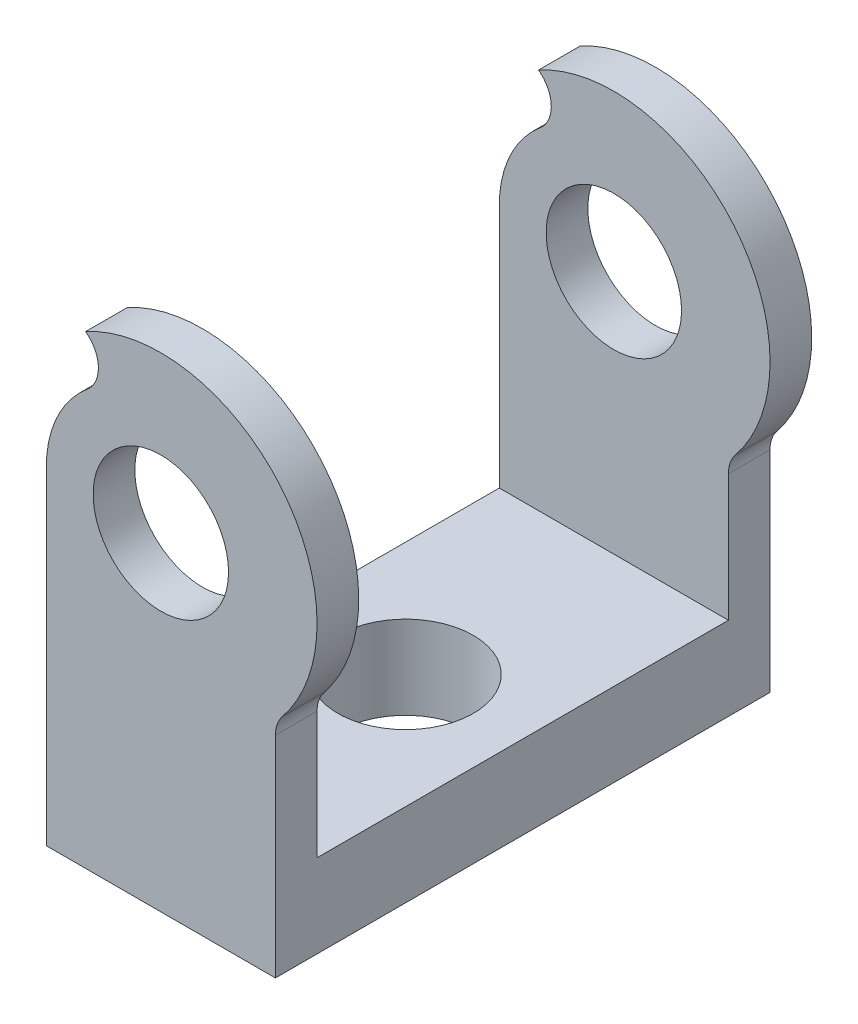
from build123d import *

# Parameters (mm, degrees)
BOSS_EXTRUDE1_DEPTH = 4
SKETCH2_W           = 22
SKETCH2_H           = 8
BOSS_EXTRUDE2_DEPTH = 39.5
BOSS_EXTRUDE3_DEPTH = 4
FILLET1_R           = 3
SKETCH4_R           = 6.5
CUT_EXTRUDE1_DEPTH  = 72.375766196
CUT_EXTRUDE2_REACH  = 73.376
SKETCH5_R           = 6.5


with BuildPart() as part:
    # Sketch1 → Boss-Extrude1 (new body)
    with BuildSketch(Plane.XY):
        with BuildLine():
            Line((0, 0), (22, 0))
            Line((22, 0), (22, 21.301960973))
            ThreePointArc((22, 21.301960973), (22.819670179, 40.735550707), (3.764629611, 44.63961245))
            ThreePointArc((3.764629611, 44.63961245), (4.991727504, 42.319183704), (3.923405192, 39.92150853))
            ThreePointArc((3.923405192, 39.92150853), (1.028978415, 36.145291009), (0, 31.5))
            Line((0, 31.5), (0, 0))
        make_face()
    extrude(amount=BOSS_EXTRUDE1_DEPTH)

    # Sketch2 → Boss-Extrude2 (add)
    with BuildSketch(Plane.XY.offset(4)):
        with Locations((11, 4)):
            Rectangle(SKETCH2_W, SKETCH2_H)
    extrude(amount=BOSS_EXTRUDE2_DEPTH)

    # Sketch3 → Boss-Extrude3 (add)
    with BuildSketch(Plane.XY.offset(43.5)):
        with BuildLine():
            Line((0, 0), (22, 0))
            Line((22, 0), (22, 21.301960973))
            ThreePointArc((22, 21.301960973), (22.822920693, 40.731389185), (3.773882637, 44.644703414))
            ThreePointArc((3.773882637, 44.644703414), (4.999346476, 42.323411278), (3.929336293, 39.926488874))
            ThreePointArc((3.929336293, 39.926488874), (1.030614343, 36.148800879), (0, 31.5))
            Line((0, 31.5), (0, 0))
        make_face()
    extrude(amount=BOSS_EXTRUDE3_DEPTH)

    # Fillet1
    fillet1_edges = [part.edges().sort_by_distance(p)[0] for p in [
        (22, 21.301960973, 2),
        (22, 21.301960973, 45.5),
    ]]
    fillet(fillet1_edges, radius=FILLET1_R)

    # Sketch4 → Cut-Extrude1 (cut, through all)
    with BuildSketch(Plane.XY.offset(47.5)):
        with Locations((11, 31.5)):
            Circle(SKETCH4_R)
    extrude(amount=-CUT_EXTRUDE1_DEPTH, mode=Mode.SUBTRACT)

    # Sketch5 → Cut-Extrude2 (cut, up to next)
    with BuildSketch(Plane(origin=(0, 0, 0), x_dir=(-1, 0, 0), z_dir=(0, -1, 0)), mode=Mode.PRIVATE) as cut_extrude2_sk1:
        with Locations(Location((-11, -24, 0), (0, 0, 90))):
            Circle(SKETCH5_R)
    cut_extrude2_tool1 = extrude(cut_extrude2_sk1.sketch, amount=-CUT_EXTRUDE2_REACH, mode=Mode.PRIVATE) & part.part
    add(cut_extrude2_tool1.solids().sort_by_distance((11, 0, 24))[0], mode=Mode.SUBTRACT)


solid = part.part
